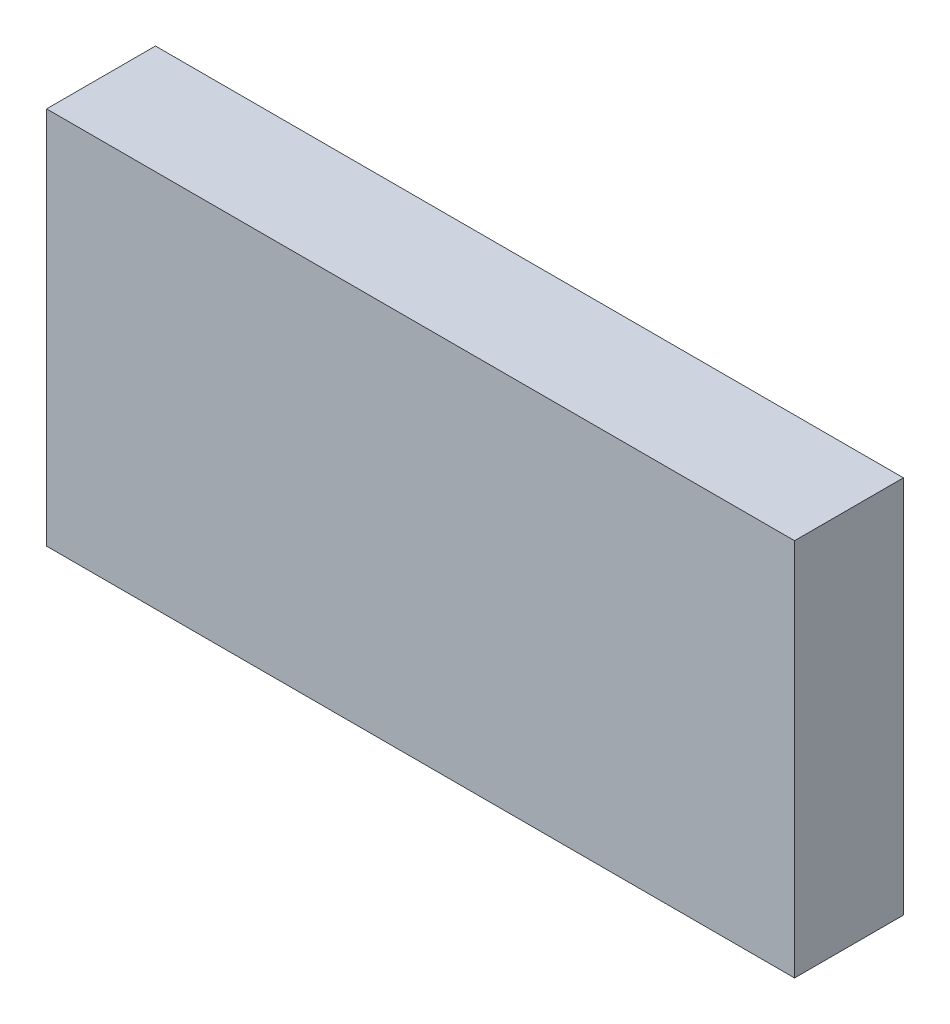
from build123d import *

# Parameters (mm, degrees)
SKETCH1_W           = 125.4125
SKETCH1_H           = 63.5
BOSS_EXTRUDE1_DEPTH = 9.128125


with BuildPart() as part:
    # Sketch1 → Boss-Extrude1 (new, symmetric)
    with BuildSketch(Plane.XY):
        Rectangle(SKETCH1_W, SKETCH1_H)
    extrude(amount=BOSS_EXTRUDE1_DEPTH, both=True)


solid = part.part
